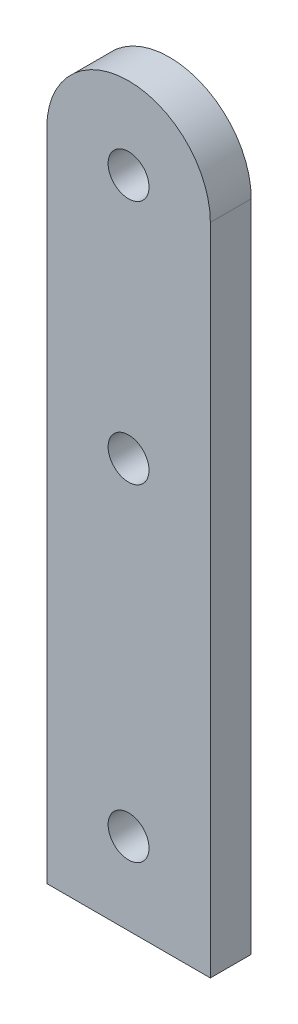
from build123d import *

# Parameters (mm, degrees)
SKETCH1_R           = 3.175
BOSS_EXTRUDE1_DEPTH = 6.35
SKETCH2_R           = 3.175
CUT_EXTRUDE1_DEPTH  = 118.260276735


with BuildPart() as part:
    # Sketch1 → Boss-Extrude1 (new body)
    with BuildSketch(Plane.XY):
        with BuildLine():
            Line((0, 0), (0, 101.6))
            ThreePointArc((0, 101.6), (12.7, 114.3), (25.4, 101.6))
            Line((25.4, 101.6), (25.4, 0))
            Line((25.4, 0), (0, 0))
        make_face()
        with Locations((12.7, 101.6)):
            Circle(SKETCH1_R, mode=Mode.SUBTRACT)
    extrude(amount=BOSS_EXTRUDE1_DEPTH)

    # Sketch2 → Cut-Extrude1 (cut, through all)
    with BuildSketch(Plane.XY.offset(6.35)):
        with Locations((12.7, 63.5)):
            Circle(SKETCH2_R)
        with Locations((12.7, 12.7)):
            Circle(SKETCH2_R)
    extrude(amount=-CUT_EXTRUDE1_DEPTH, mode=Mode.SUBTRACT)


solid = part.part
